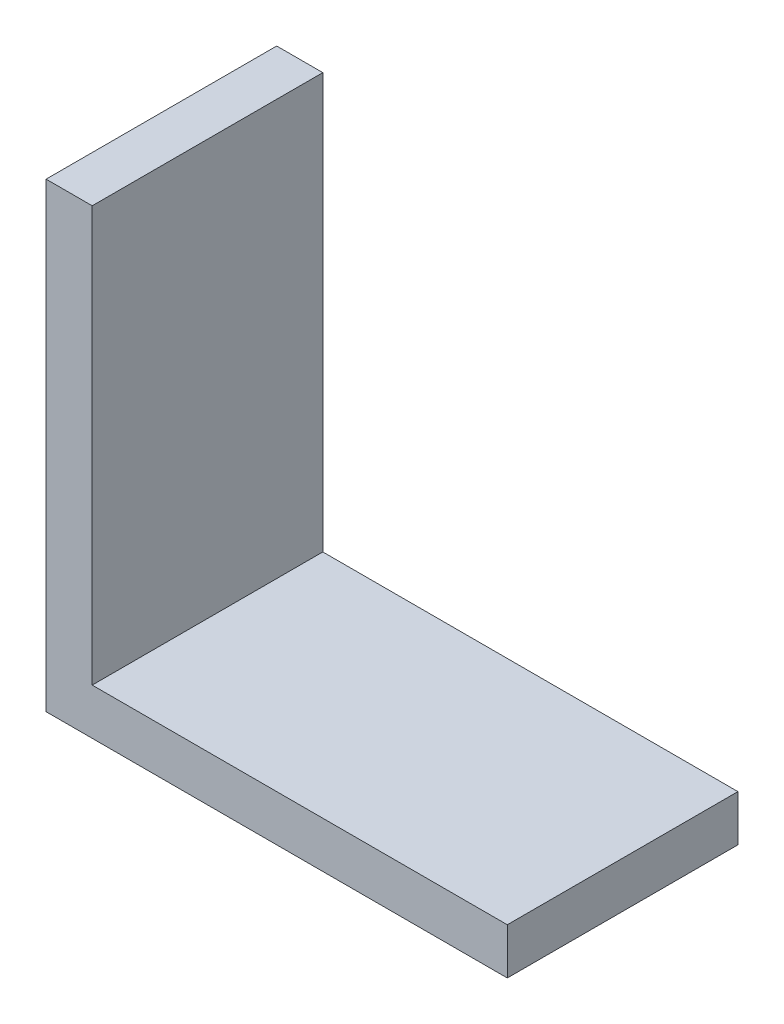
from build123d import *

# Parameters (mm, degrees)
LINEAR_AUSTRAGEN_D_NN1_DEPTH = 10


with BuildPart() as part:
    # Skizze1 → Linear-Austragen-Dünn1 (new, symmetric)
    with BuildSketch(Plane.XY):
        Polygon((0, 40), (0, 0), (40, 0), (40, 4), (4, 4), (4, 40), align=None)
    extrude(amount=LINEAR_AUSTRAGEN_D_NN1_DEPTH, both=True)


solid = part.part
